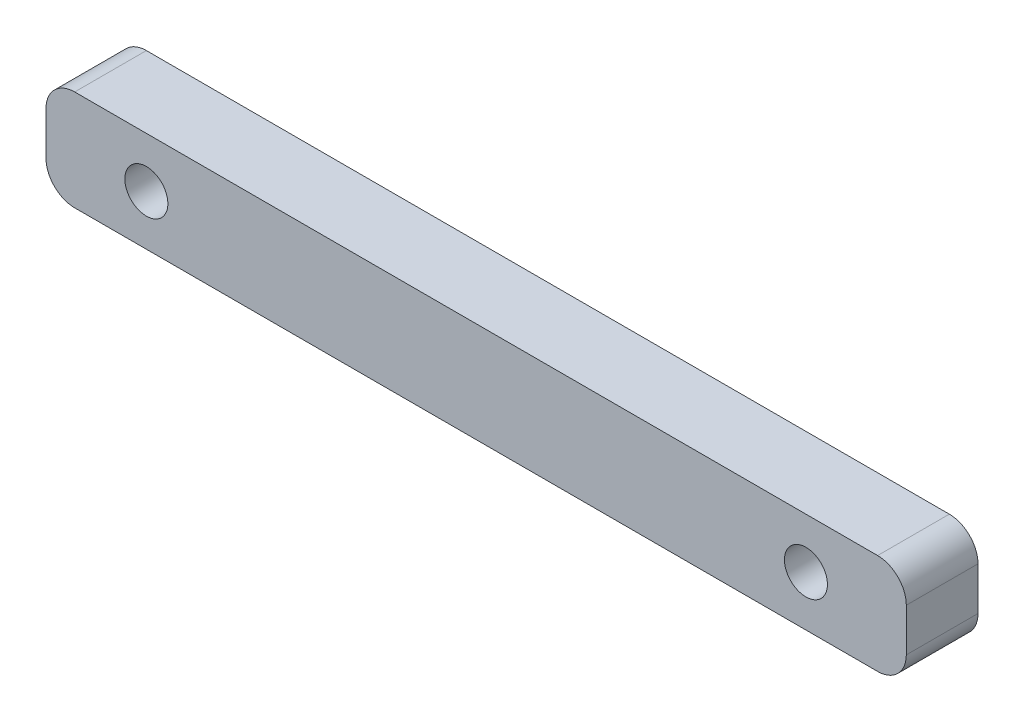
from build123d import *

# Parameters (mm, degrees)
SKETCH_2_W      = 60
SKETCH_2_H      = 7
SKETCH_2_R      = 1.5
EXTRUDE_1_DEPTH = 5
FILLET_5_R      = 2


with BuildPart() as part:
    # 草图2 → 凸台-拉伸1 (new body)
    with BuildSketch(Plane.XY):
        Rectangle(SKETCH_2_W, SKETCH_2_H)
        with Locations((-23, 0)):
            Circle(SKETCH_2_R, mode=Mode.SUBTRACT)
        with Locations(Location((23, 0, 0), (0, 0, 180))):
            Circle(SKETCH_2_R, mode=Mode.SUBTRACT)
    extrude(amount=EXTRUDE_1_DEPTH)

    # 圆角5
    fillet_5_edges = [part.edges().sort_by_distance(p)[0] for p in [
        (30, -3.5, 2.5),
        (-30, -3.5, 2.5),
        (-30, 3.5, 2.5),
        (30, 3.5, 2.5),
    ]]
    fillet(fillet_5_edges, radius=FILLET_5_R)


solid = part.part
